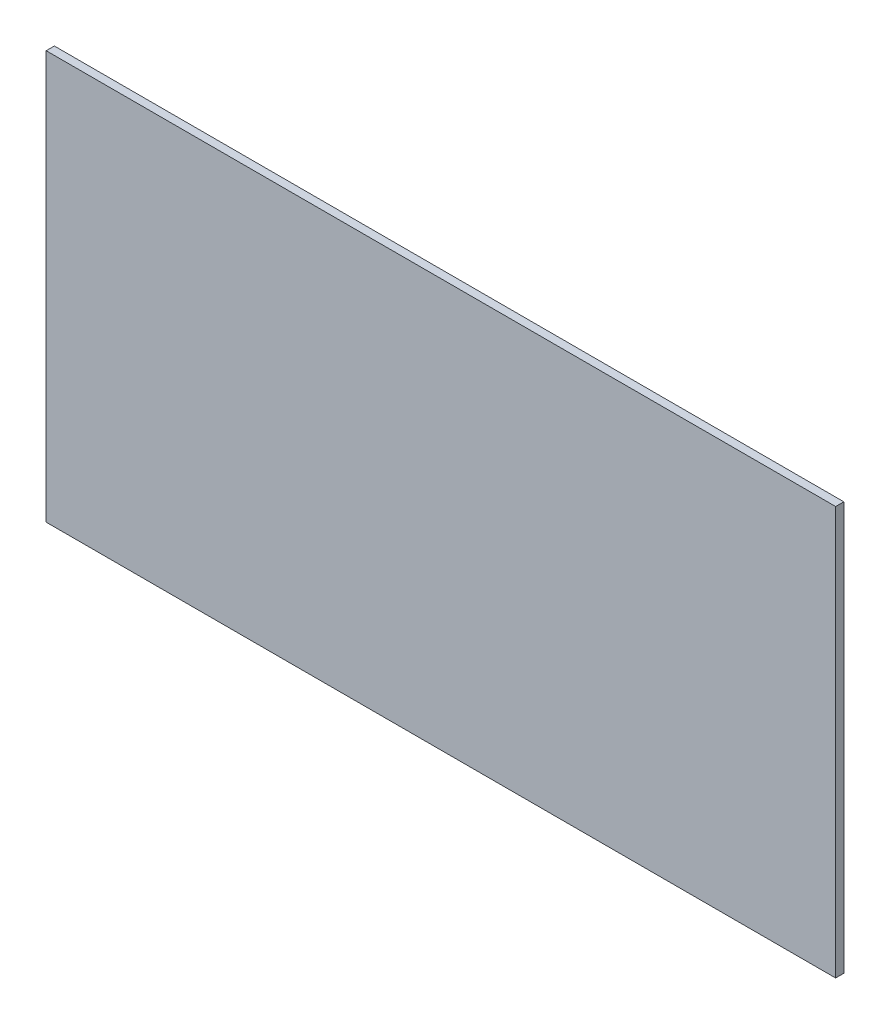
from build123d import *

# Parameters (mm, degrees)
SKETCH1_W           = 290
SKETCH1_H           = 150
BOSS_EXTRUDE1_DEPTH = 3


with BuildPart() as part:
    # Sketch1 → Boss-Extrude1 (new body)
    with BuildSketch(Plane.XY):
        Rectangle(SKETCH1_W, SKETCH1_H)
    extrude(amount=BOSS_EXTRUDE1_DEPTH)


solid = part.part
